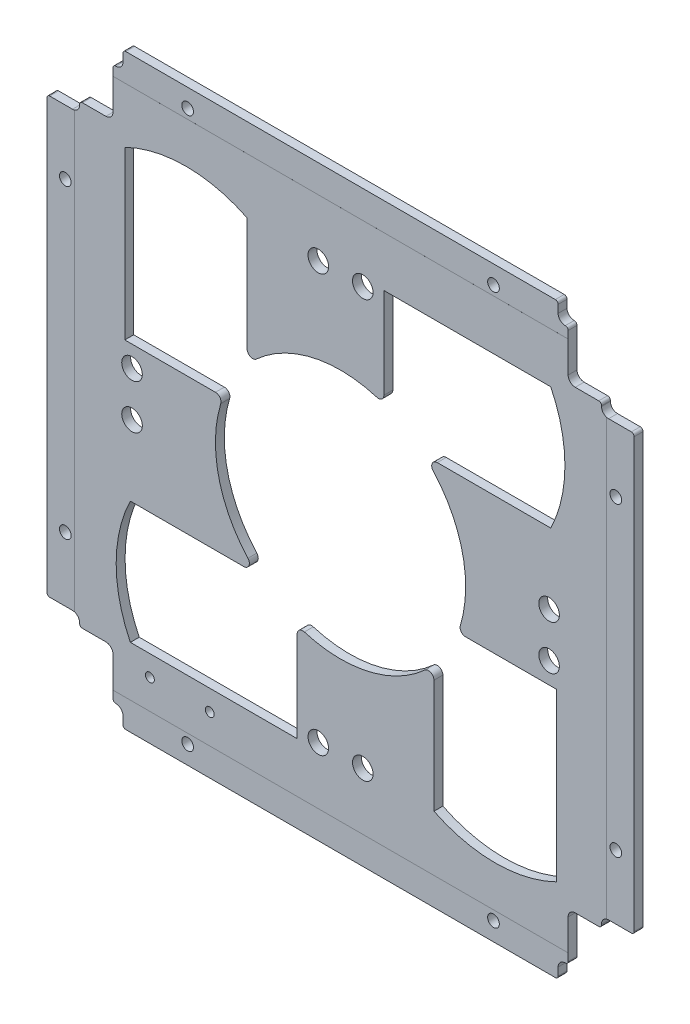
from build123d import *

# Parameters (mm, degrees)
SKETCH1_W                           = 106
SKETCH1_H                           = 106
MAINOUTLINE_DEPTH                   = 1.6
SKETCH4_W                           = 11.7
SKETCH4_H                           = 11.7
RAILCUTOUTS_DEPTH                   = 75.970394157
SKETCH13_W                          = 5.7
SKETCH13_H                          = 1.9
SKETCH13_W_2                        = 1.8
SKETCH13_H_2                        = 3
FILLETCUTOUTS_DEPTH                 = 75.970394157
SMOOTHCORNER_DEPTH                  = 10
MIRROR2_COPY_1_SKETCH_W             = 11.7
MIRROR2_COPY_1_SKETCH_H             = 11.7
MIRROR2_COPY_1_DEPTH                = 75.970394157
MIRROR2_COPY_2_SKETCH_W             = 5.7
MIRROR2_COPY_2_SKETCH_H             = 1.9
MIRROR2_COPY_2_SKETCH_W_2           = 1.8
MIRROR2_COPY_2_SKETCH_H_2           = 3
MIRROR2_COPY_2_DEPTH                = 75.970394157
MIRROR2_COPY_3_DEPTH                = 10
MIRROR2_COPY_4_SKETCH_W             = 11.7
MIRROR2_COPY_4_SKETCH_H             = 11.7
MIRROR2_COPY_4_DEPTH                = 75.970394157
MIRROR2_COPY_5_SKETCH_W             = 5.7
MIRROR2_COPY_5_SKETCH_H             = 1.9
MIRROR2_COPY_5_SKETCH_W_2           = 1.8
MIRROR2_COPY_5_SKETCH_H_2           = 3
MIRROR2_COPY_5_DEPTH                = 75.970394157
MIRROR2_COPY_6_DEPTH                = 10
FILLET10_R                          = 0.5
M2_CLEARANCE_HOLE1_D                = 2.1
INTERBOARDCONNECTORHOLES_DEPTH      = 75.970394157
INTERBOARDCONNECTORHOLES_DEPTH_BACK = 75.970394157
SKETCH12_R                          = 0.8
SKETCH16_W                          = 90
SKETCH16_H                          = 5.2
SKETCH16_W_2                        = 5.2
SKETCH16_H_2                        = 90
CUT_EXTRUDE6_DEPTH                  = 0.001
CUT_EXTRUDE10_DEPTH                 = 75.970394157
CUT_EXTRUDE10_DEPTH_BACK            = 75.970394157
SKETCH21_R                          = 22.5
SKETCH24_OUTSIDE_W                  = 137.984
SKETCH24_OUTSIDE_H                  = 137.984
SKETCH24_OUTSIDE_W_2                = 105.6
SKETCH24_OUTSIDE_H_2                = 105.6
CUT_EXTRUDE19_DEPTH                 = 75.970394157
FILLET7_R                           = 0.5
F_1_0MM_DOWEL_HOLE1_D               = 3.7
CUT_EXTRUDE23_DEPTH                 = 75.687616109
FILLET14_R                          = 1


with BuildPart() as part:
    # Sketch1 → mainOutline (new body)
    with BuildSketch(Plane.XY):
        Rectangle(SKETCH1_W, SKETCH1_H)
    extrude(amount=MAINOUTLINE_DEPTH)

    # Sketch4 → railCutouts (cut, through all)
    with BuildSketch(Plane(origin=(0, 0, 0), x_dir=(-1, 0, 0), z_dir=(0, 0, -1))):
        with Locations((47.15, 47.15)):
            Rectangle(SKETCH4_W, SKETCH4_H)
    railcutouts = extrude(amount=-RAILCUTOUTS_DEPTH, mode=Mode.SUBTRACT)

    # Sketch13 → filletCutouts (cut, symmetric)
    with BuildSketch(Plane(origin=(0, 0, 0), x_dir=(-1, 0, 0), z_dir=(0, 0, -1))):
        with Locations((50.15, 40.35)):
            Rectangle(SKETCH13_W, SKETCH13_H)
        with Locations((40.4, 51.5)):
            Rectangle(SKETCH13_W_2, SKETCH13_H_2)
    filletcutouts = extrude(amount=FILLETCUTOUTS_DEPTH, both=True, mode=Mode.SUBTRACT)

    # Sketch27 → smoothCorner (cut)
    with BuildSketch(Plane.XY.offset(1.6)):
        with BuildLine():
            Line((-40.928025612, 42.198025612), (-40.928025612, 49.628025612))
            Line((-40.928025612, 49.628025612), (-40.398025612, 49.628025612))
            ThreePointArc((-40.398025612, 49.628025612), (-39.5, 50), (-39.128025612, 50.898025612))
            Line((-39.128025612, 50.898025612), (-39.128025612, 53))
            Line((-39.128025612, 53), (-53, 53))
            Line((-53, 53), (-53, 39.028025612))
            Line((-53, 39.028025612), (-48.198025612, 39.028025612))
            ThreePointArc((-48.198025612, 39.028025612), (-47.3, 39.4), (-46.928025612, 40.298025612))
            Line((-46.928025612, 40.298025612), (-46.928025612, 40.928025612))
            Line((-46.928025612, 40.928025612), (-42.198025612, 40.928025612))
            ThreePointArc((-42.198025612, 40.928025612), (-41.3, 41.3), (-40.928025612, 42.198025612))
        make_face()
    smoothcorner = extrude(amount=-SMOOTHCORNER_DEPTH, mode=Mode.SUBTRACT)

    # Mirror1: railCutouts, filletCutouts, smoothCorner across plane
    add(railcutouts.mirror(Plane(origin=(0, 0, 0), x_dir=(0, 0, 1), z_dir=(1, 0, 0))), mode=Mode.SUBTRACT)
    add(filletcutouts.mirror(Plane(origin=(0, 0, 0), x_dir=(0, 0, 1), z_dir=(1, 0, 0))), mode=Mode.SUBTRACT)
    add(smoothcorner.mirror(Plane(origin=(0, 0, 0), x_dir=(0, 0, 1), z_dir=(1, 0, 0))), mode=Mode.SUBTRACT)

    # Mirror2 copy 1 sketch → Mirror2 copy 1 (cut, through all)
    with BuildSketch(Plane(origin=(0, 0, 0), x_dir=(1, 0, 0), z_dir=(0, 0, -1))):
        with Locations((47.15, 47.15)):
            Rectangle(MIRROR2_COPY_1_SKETCH_W, MIRROR2_COPY_1_SKETCH_H)
    extrude(amount=-MIRROR2_COPY_1_DEPTH, mode=Mode.SUBTRACT)

    # Mirror2 copy 2 sketch → Mirror2 copy 2 (cut, symmetric)
    with BuildSketch(Plane(origin=(0, 0, 0), x_dir=(1, 0, 0), z_dir=(0, 0, -1))):
        with Locations((50.15, 40.35)):
            Rectangle(MIRROR2_COPY_2_SKETCH_W, MIRROR2_COPY_2_SKETCH_H)
        with Locations((40.4, 51.5)):
            Rectangle(MIRROR2_COPY_2_SKETCH_W_2, MIRROR2_COPY_2_SKETCH_H_2)
    extrude(amount=MIRROR2_COPY_2_DEPTH, both=True, mode=Mode.SUBTRACT)

    # Mirror2 copy 3 sketch → Mirror2 copy 3 (cut)
    with BuildSketch(Plane(origin=(0, 0, 1.6), x_dir=(-1, 0, 0), z_dir=(0, 0, 1))):
        with BuildLine():
            Line((-40.928025612, 42.198025612), (-40.928025612, 49.628025612))
            Line((-40.928025612, 49.628025612), (-40.398025612, 49.628025612))
            ThreePointArc((-40.398025612, 49.628025612), (-39.5, 50), (-39.128025612, 50.898025612))
            Line((-39.128025612, 50.898025612), (-39.128025612, 53))
            Line((-39.128025612, 53), (-53, 53))
            Line((-53, 53), (-53, 39.028025612))
            Line((-53, 39.028025612), (-48.198025612, 39.028025612))
            ThreePointArc((-48.198025612, 39.028025612), (-47.3, 39.4), (-46.928025612, 40.298025612))
            Line((-46.928025612, 40.298025612), (-46.928025612, 40.928025612))
            Line((-46.928025612, 40.928025612), (-42.198025612, 40.928025612))
            ThreePointArc((-42.198025612, 40.928025612), (-41.3, 41.3), (-40.928025612, 42.198025612))
        make_face()
    extrude(amount=-MIRROR2_COPY_3_DEPTH, mode=Mode.SUBTRACT)

    # Mirror2 copy 4 sketch → Mirror2 copy 4 (cut, through all)
    with BuildSketch(Plane(origin=(0, 0, 0), x_dir=(-1, 0, 0), z_dir=(0, 0, -1))):
        with Locations((47.15, -47.15)):
            Rectangle(MIRROR2_COPY_4_SKETCH_W, MIRROR2_COPY_4_SKETCH_H)
    extrude(amount=-MIRROR2_COPY_4_DEPTH, mode=Mode.SUBTRACT)

    # Mirror2 copy 5 sketch → Mirror2 copy 5 (cut, symmetric)
    with BuildSketch(Plane(origin=(0, 0, 0), x_dir=(-1, 0, 0), z_dir=(0, 0, -1))):
        with Locations((50.15, -40.35)):
            Rectangle(MIRROR2_COPY_5_SKETCH_W, MIRROR2_COPY_5_SKETCH_H)
        with Locations((40.4, -51.5)):
            Rectangle(MIRROR2_COPY_5_SKETCH_W_2, MIRROR2_COPY_5_SKETCH_H_2)
    extrude(amount=MIRROR2_COPY_5_DEPTH, both=True, mode=Mode.SUBTRACT)

    # Mirror2 copy 6 sketch → Mirror2 copy 6 (cut)
    with BuildSketch(Plane.XY.offset(1.6)):
        with BuildLine():
            Line((-40.928025612, -42.198025612), (-40.928025612, -49.628025612))
            Line((-40.928025612, -49.628025612), (-40.398025612, -49.628025612))
            ThreePointArc((-40.398025612, -49.628025612), (-39.5, -50), (-39.128025612, -50.898025612))
            Line((-39.128025612, -50.898025612), (-39.128025612, -53))
            Line((-39.128025612, -53), (-53, -53))
            Line((-53, -53), (-53, -39.028025612))
            Line((-53, -39.028025612), (-48.198025612, -39.028025612))
            ThreePointArc((-48.198025612, -39.028025612), (-47.3, -39.4), (-46.928025612, -40.298025612))
            Line((-46.928025612, -40.298025612), (-46.928025612, -40.928025612))
            Line((-46.928025612, -40.928025612), (-42.198025612, -40.928025612))
            ThreePointArc((-42.198025612, -40.928025612), (-41.3, -41.3), (-40.928025612, -42.198025612))
        make_face()
    extrude(amount=-MIRROR2_COPY_6_DEPTH, mode=Mode.SUBTRACT)

    # Fillet10
    fillet10_edges = [part.edges().sort_by_distance(p)[0] for p in [
        (46.928025612, -40.928025612, 0.8),
        (40.928025612, -49.628025612, 0.8),
        (40.928025612, 49.628025612, 0.8),
        (46.928025612, 40.928025612, 0.8),
        (-46.928025612, 40.928025612, 0.8),
        (-40.928025612, 49.628025612, 0.8),
        (-46.928025612, -40.928025612, 0.8),
        (-40.928025612, -49.628025612, 0.8),
    ]]
    fillet(fillet10_edges, radius=FILLET10_R)

    # M2 Clearance Hole1 (through all)
    with Locations(Plane(origin=(0, 0, 0), x_dir=(-1, 0, 0), z_dir=(0, 0, -1))):
        with Locations((49.5, -27.5), (27.5, -49.5), (-49.5, -27.5), (-27.5, -49.5), (-27.5, 49.5), (-49.5, 27.5), (27.5, 49.5), (49.5, 27.5)):
            Hole(M2_CLEARANCE_HOLE1_D / 2)

    # Sketch12 → interboardConnectorHoles (cut, two sides: drawn at the far end of the back side and taken through both)
    with BuildSketch(Plane.XY.offset(1.6).offset(-INTERBOARDCONNECTORHOLES_DEPTH_BACK)):
        with Locations((-34.285, -42.5)):
            Circle(SKETCH12_R)
        with Locations((-23.515, -42.5)):
            Circle(SKETCH12_R)
    extrude(amount=INTERBOARDCONNECTORHOLES_DEPTH + INTERBOARDCONNECTORHOLES_DEPTH_BACK, mode=Mode.SUBTRACT)

    # Sketch16 → Cut-Extrude6 (cut)
    with BuildSketch(Plane.XY.offset(1.6)):
        with Locations((0, -50.4)):
            Rectangle(SKETCH16_W, SKETCH16_H)
        with Locations((0, 50.4)):
            Rectangle(SKETCH16_W, SKETCH16_H)
        with Locations((-50.4, 0)):
            Rectangle(SKETCH16_W_2, SKETCH16_H_2)
        with Locations((50.4, 0)):
            Rectangle(SKETCH16_W_2, SKETCH16_H_2)
    extrude(amount=-CUT_EXTRUDE6_DEPTH, mode=Mode.SUBTRACT)

    # Sketch21 → Cut-Extrude10 (cut, two sides: drawn at the far end of the back side and taken through both)
    with BuildSketch(Plane.XY.offset(-CUT_EXTRUDE10_DEPTH_BACK)):
        Circle(SKETCH21_R)
    extrude(amount=CUT_EXTRUDE10_DEPTH + CUT_EXTRUDE10_DEPTH_BACK, mode=Mode.SUBTRACT)

    # Sketch24 outside → Cut-Extrude19 (cut, through all)
    with BuildSketch(Plane.XY.offset(1.6)):
        Rectangle(SKETCH24_OUTSIDE_W, SKETCH24_OUTSIDE_H)
        Rectangle(SKETCH24_OUTSIDE_W_2, SKETCH24_OUTSIDE_H_2, mode=Mode.SUBTRACT)
    extrude(amount=-CUT_EXTRUDE19_DEPTH, mode=Mode.SUBTRACT)

    # Fillet7
    fillet7_edges = [part.edges().sort_by_distance(p)[0] for p in [
        (-52.8, -39.028025612, 0.7995),
        (-39.128025612, -52.8, 0.7995),
        (39.128025612, -52.8, 0.7995),
        (52.8, -39.028025612, 0.7995),
        (52.8, 39.028025612, 0.7995),
        (39.128025612, 52.8, 0.7995),
        (-39.128025612, 52.8, 0.7995),
        (-52.8, 39.028025612, 0.7995),
    ]]
    fillet(fillet7_edges, radius=FILLET7_R)

    # Ø1.0mm Dowel Hole1 (through all)
    with Locations(Plane(origin=(-37.5, 4, 0), x_dir=(-1, 0, 0), z_dir=(0, 0, -1))):
        with Locations((0, 0), (0, -8), (-33.5, -41.5), (-41.5, -41.5), (-75, -8), (-75, 0), (-41.5, 33.5), (-33.5, 33.5)):
            Hole(F_1_0MM_DOWEL_HOLE1_D / 2)

    # Sketch33 → Cut-Extrude23 (cut, through all)
    with BuildSketch(Plane(origin=(0, 0, 0), x_dir=(-1, 0, 0), z_dir=(0, 0, -1))):
        with BuildLine():
            Line((-7.8, 16.8), (-7.8, 38.8))
            Line((-7.8, 38.8), (-37.8, 38.8))
            ThreePointArc((-37.8, 38.8), (-40.350055679, 27.8), (-37.8, 16.8))
            Line((-37.8, 16.8), (-7.8, 16.8))
        make_face()
        with BuildLine():
            Line((-16.8, -7.8), (-38.8, -7.8))
            Line((-38.8, -7.8), (-38.8, -37.8))
            ThreePointArc((-38.8, -37.8), (-27.8, -40.350055679), (-16.8, -37.8))
            Line((-16.8, -37.8), (-16.8, -7.8))
        make_face()
        with BuildLine():
            Line((16.8, 7.8), (38.8, 7.8))
            Line((38.8, 7.8), (38.8, 37.8))
            ThreePointArc((38.8, 37.8), (27.8, 40.350055679), (16.8, 37.8))
            Line((16.8, 37.8), (16.8, 7.8))
        make_face()
        with BuildLine():
            Line((7.8, -16.8), (7.8, -38.8))
            Line((7.8, -38.8), (37.8, -38.8))
            ThreePointArc((37.8, -38.8), (40.350055679, -27.8), (37.8, -16.8))
            Line((37.8, -16.8), (7.8, -16.8))
        make_face()
    extrude(amount=-CUT_EXTRUDE23_DEPTH, mode=Mode.SUBTRACT)

    # Fillet14
    fillet14_edges = [part.edges().sort_by_distance(p)[0] for p in [
        (7.8, 21.104738804, 0.8),
        (14.96696362, 16.8, 0.8),
        (21.104738804, -7.8, 0.8),
        (16.8, -14.96696362, 0.8),
        (-16.8, 14.96696362, 0.8),
        (-21.104738804, 7.8, 0.8),
        (-7.8, -21.104738804, 0.8),
        (-14.96696362, -16.8, 0.8),
    ]]
    fillet(fillet14_edges, radius=FILLET14_R)


solid = part.part
